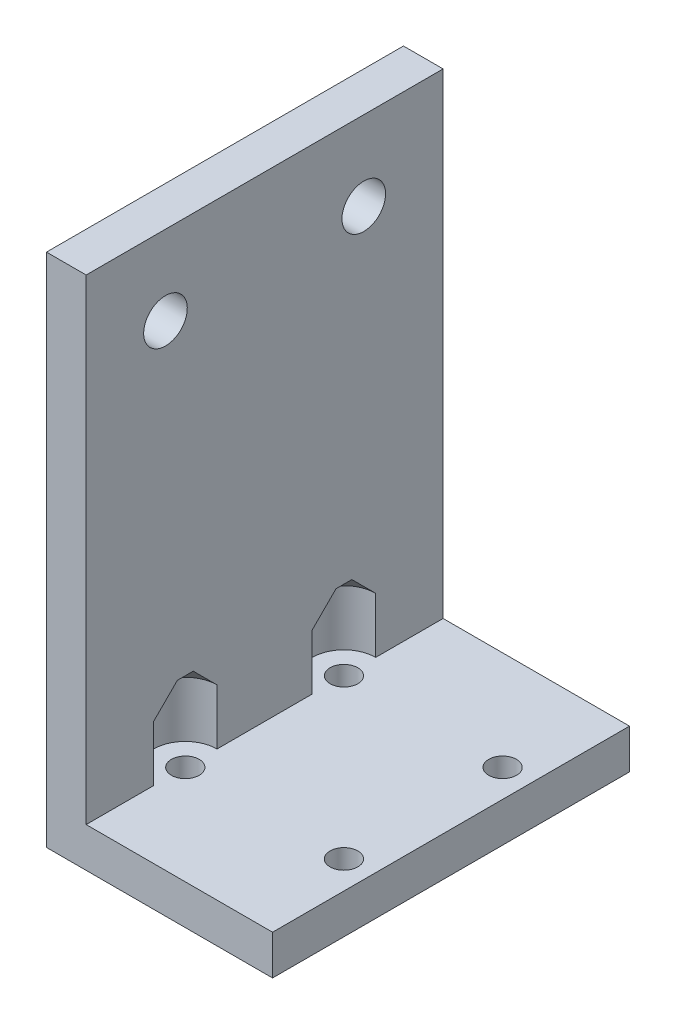
from build123d import *

# Parameters (mm, degrees)
BOSS_EXTRU_1_DEPTH      = 45
ENL_V_MAT_EXTRU_1_REACH = 83.904
ESQUISSE2_R             = 1.75
ENL_V_MAT_EXTRU_2_REACH = 86.037
ESQUISSE3_R             = 2.75
ESQUISSE4_R             = 4
ENL_V_MAT_EXTRU_3_DEPTH = 10
CHANFREIN1_SIZE         = 3


with BuildPart() as part:
    # Esquisse1 → Boss.-Extru.1 (new body)
    with BuildSketch(Plane.XY):
        Polygon((-32.913141208, 0), (-4.413141208, 0), (-4.413141208, 5), (-27.913141208, 5), (-27.913141208, 65), (-32.913141208, 65), align=None)
    extrude(amount=BOSS_EXTRU_1_DEPTH)

    # Esquisse2 → Enlèv. mat.-Extru.1 (cut, up to next)
    with BuildSketch(Plane(origin=(0, 5, 0), x_dir=(1, 0, 0), z_dir=(0, 1, 0)), mode=Mode.PRIVATE) as enl_v_mat_extru_1_sk1:
        with Locations(Location((-27.913141208, -32.5, 0), (0, 0, 270))):
            Circle(ESQUISSE2_R)
    enl_v_mat_extru_1_tool1 = extrude(enl_v_mat_extru_1_sk1.sketch, amount=-ENL_V_MAT_EXTRU_1_REACH, mode=Mode.PRIVATE) & part.part
    # Esquisse2 → Enlèv. mat.-Extru.1 (cut, up to next)
    with BuildSketch(Plane(origin=(0, 5, 0), x_dir=(1, 0, 0), z_dir=(0, 1, 0)), mode=Mode.PRIVATE) as enl_v_mat_extru_1_sk2:
        with Locations(Location((-27.913141208, -12.5, 0), (0, 0, 270))):
            Circle(ESQUISSE2_R)
    enl_v_mat_extru_1_tool2 = extrude(enl_v_mat_extru_1_sk2.sketch, amount=-ENL_V_MAT_EXTRU_1_REACH, mode=Mode.PRIVATE) & part.part
    # Esquisse2 → Enlèv. mat.-Extru.1 (cut, up to next)
    with BuildSketch(Plane(origin=(0, 5, 0), x_dir=(1, 0, 0), z_dir=(0, 1, 0)), mode=Mode.PRIVATE) as enl_v_mat_extru_1_sk3:
        with Locations(Location((-7.913141208, -12.5, 0), (0, 0, 180))):
            Circle(ESQUISSE2_R)
    enl_v_mat_extru_1_tool3 = extrude(enl_v_mat_extru_1_sk3.sketch, amount=-ENL_V_MAT_EXTRU_1_REACH, mode=Mode.PRIVATE) & part.part
    # Esquisse2 → Enlèv. mat.-Extru.1 (cut, up to next)
    with BuildSketch(Plane(origin=(0, 5, 0), x_dir=(1, 0, 0), z_dir=(0, 1, 0)), mode=Mode.PRIVATE) as enl_v_mat_extru_1_sk4:
        with Locations(Location((-7.913141208, -32.5, 0), (0, 0, 180))):
            Circle(ESQUISSE2_R)
    enl_v_mat_extru_1_tool4 = extrude(enl_v_mat_extru_1_sk4.sketch, amount=-ENL_V_MAT_EXTRU_1_REACH, mode=Mode.PRIVATE) & part.part
    add(enl_v_mat_extru_1_tool1.solids().sort_by_distance((-27.913141, 5, 32.5))[0], mode=Mode.SUBTRACT)
    add(enl_v_mat_extru_1_tool2.solids().sort_by_distance((-27.913141, 5, 12.5))[0], mode=Mode.SUBTRACT)
    add(enl_v_mat_extru_1_tool3.solids().sort_by_distance((-7.913141, 5, 12.5))[0], mode=Mode.SUBTRACT)
    add(enl_v_mat_extru_1_tool4.solids().sort_by_distance((-7.913141, 5, 32.5))[0], mode=Mode.SUBTRACT)

    # Esquisse3 → Enlèv. mat.-Extru.2 (cut, up to next)
    with BuildSketch(Plane.ZY.offset(32.913141208), mode=Mode.PRIVATE) as enl_v_mat_extru_2_sk1:
        with Locations(Location((10, 55, 0), (0, 0, 270))):
            Circle(ESQUISSE3_R)
    enl_v_mat_extru_2_tool1 = extrude(enl_v_mat_extru_2_sk1.sketch, amount=-ENL_V_MAT_EXTRU_2_REACH, mode=Mode.PRIVATE) & part.part
    # Esquisse3 → Enlèv. mat.-Extru.2 (cut, up to next)
    with BuildSketch(Plane.ZY.offset(32.913141208), mode=Mode.PRIVATE) as enl_v_mat_extru_2_sk2:
        with Locations(Location((35, 55, 0), (0, 0, 270))):
            Circle(ESQUISSE3_R)
    enl_v_mat_extru_2_tool2 = extrude(enl_v_mat_extru_2_sk2.sketch, amount=-ENL_V_MAT_EXTRU_2_REACH, mode=Mode.PRIVATE) & part.part
    add(enl_v_mat_extru_2_tool1.solids().sort_by_distance((-32.913141, 55, 10))[0], mode=Mode.SUBTRACT)
    add(enl_v_mat_extru_2_tool2.solids().sort_by_distance((-32.913141, 55, 35))[0], mode=Mode.SUBTRACT)

    # Esquisse4 → Enlèv. mat.-Extru.3 (cut)
    with BuildSketch(Plane(origin=(0, 5, 0), x_dir=(1, 0, 0), z_dir=(0, 1, 0))):
        with Locations((-27.913141208, -32.5)):
            Circle(ESQUISSE4_R)
        with Locations((-27.913141208, -12.5)):
            Circle(ESQUISSE4_R)
    extrude(amount=ENL_V_MAT_EXTRU_3_DEPTH, mode=Mode.SUBTRACT)

    # Chanfrein1
    chanfrein1_edges = [part.edges().sort_by_distance(p)[0] for p in [
        (-31.913141208, 15, 32.5),
        (-31.913141208, 15, 12.5),
    ]]
    chamfer(chanfrein1_edges, length=CHANFREIN1_SIZE)


solid = part.part
